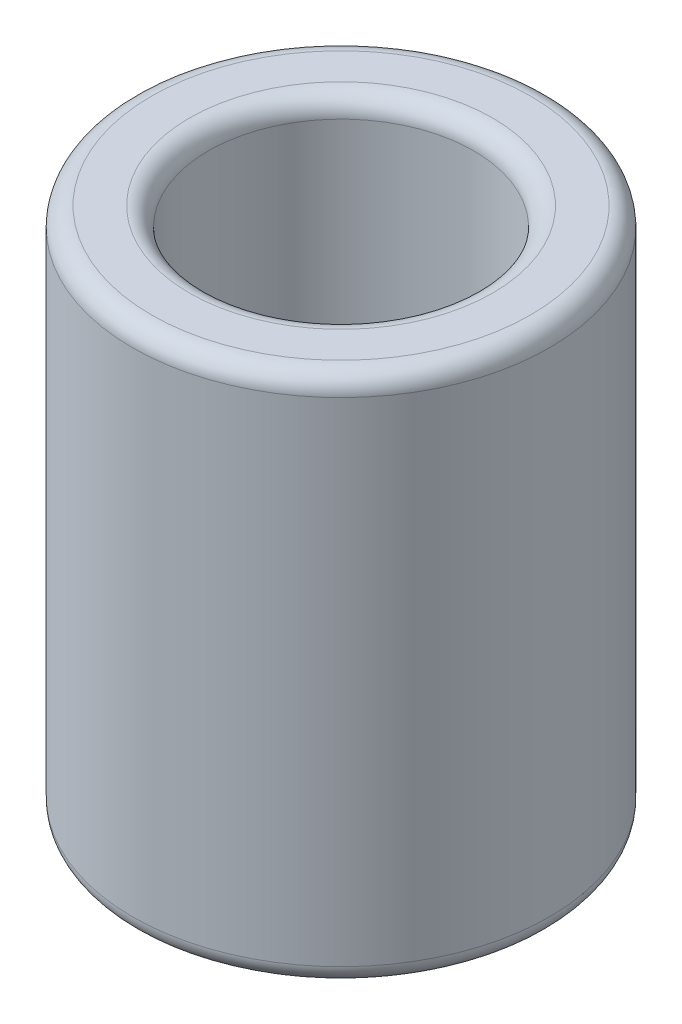
from build123d import *

# Parameters (mm, degrees)
SKETCH1_R           = 2.75
SKETCH1_R_2         = 1.75
BOSS_EXTRUDE1_DEPTH = 7
FILLET1_R           = 0.25


with BuildPart() as part:
    # Sketch1 → Boss-Extrude1 (new body)
    with BuildSketch(Plane(origin=(0, 0, 0), x_dir=(1, 0, 0), z_dir=(0, 1, 0))):
        with Locations(Location((0, 0, 0), (0, 0, 270))):
            Circle(SKETCH1_R)
        with Locations(Location((0, 0, 0), (0, 0, 270))):
            Circle(SKETCH1_R_2, mode=Mode.SUBTRACT)
    extrude(amount=BOSS_EXTRUDE1_DEPTH)

    # Fillet1
    fillet1_edges = [part.edges().sort_by_distance(p)[0] for p in [
        (0, 0, -2.75),
        (0, 7, -2.75),
        (0, 0, -1.75),
        (0, 7, -1.75),
    ]]
    fillet(fillet1_edges, radius=FILLET1_R)


solid = part.part
